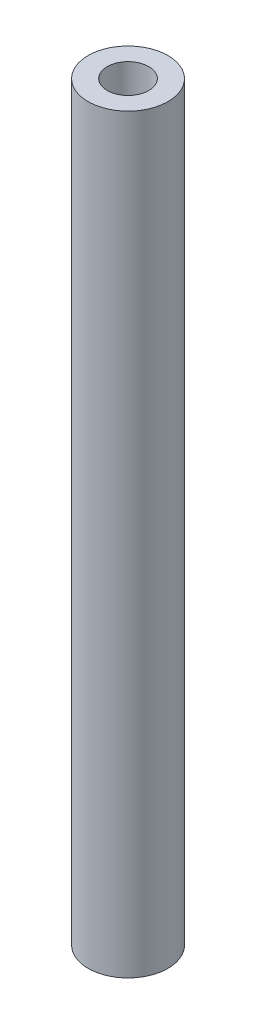
from build123d import *

# Parameters (mm, degrees)
SKETCH1_R           = 6.25
SKETCH1_R_2         = 3.25
BOSS_EXTRUDE1_DEPTH = 117.5


with BuildPart() as part:
    # Sketch1 → Boss-Extrude1 (new body)
    with BuildSketch(Plane(origin=(0, 0, 0), x_dir=(1, 0, 0), z_dir=(0, 1, 0))):
        with Locations(Location((0, 0, 0), (0, 0, 90))):
            Circle(SKETCH1_R)
        with Locations(Location((0, 0, 0), (0, 0, 90))):
            Circle(SKETCH1_R_2, mode=Mode.SUBTRACT)
    extrude(amount=BOSS_EXTRUDE1_DEPTH)


solid = part.part
